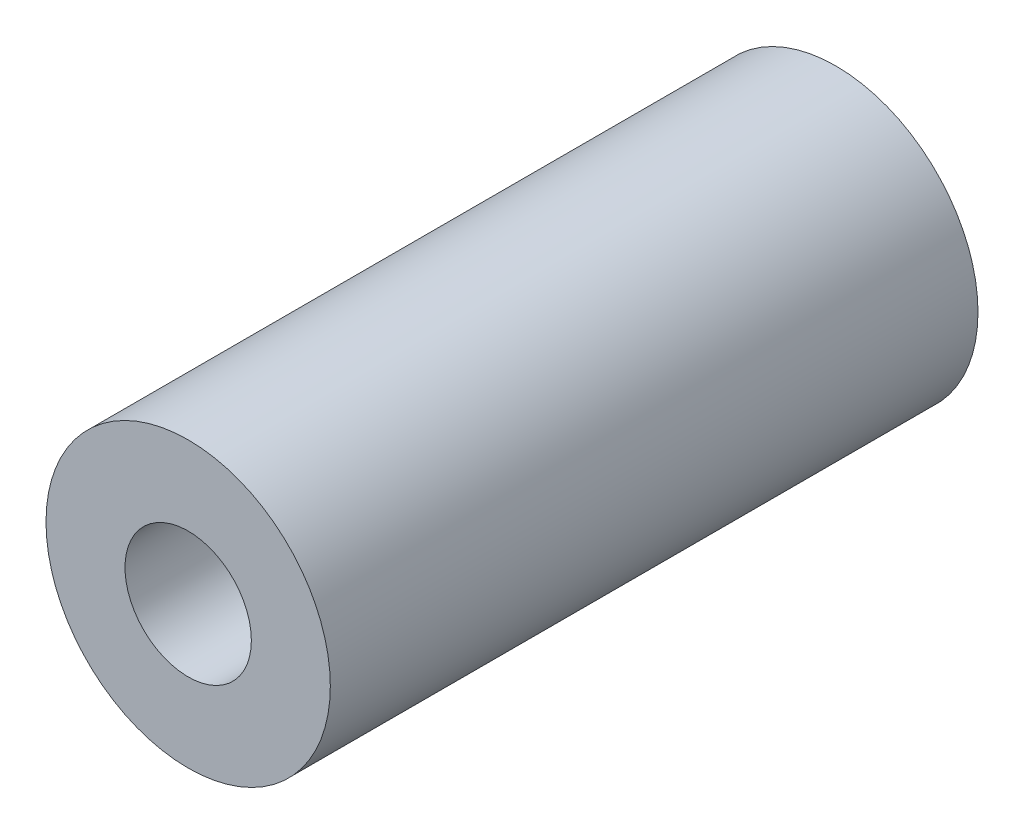
from build123d import *

# Parameters (mm, degrees)
SKIZZE1_R                       = 4.5
SKIZZE1_R_2                     = 2
AUFSATZ_LINEAR_AUSTRAGEN1_DEPTH = 20.5


with BuildPart() as part:
    # Skizze1 → Aufsatz-Linear austragen1 (new body)
    with BuildSketch(Plane.XY):
        Circle(SKIZZE1_R)
        Circle(SKIZZE1_R_2, mode=Mode.SUBTRACT)
    extrude(amount=AUFSATZ_LINEAR_AUSTRAGEN1_DEPTH)


solid = part.part
